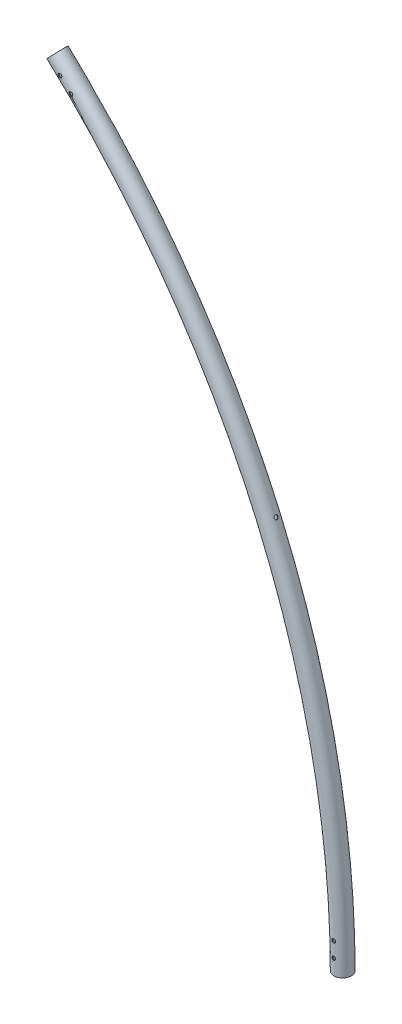
from build123d import *

# Parameters (mm, degrees)
SKETCH4_R               = 14.732
SKETCH4_R_2             = 13.3223
SKETCH11_R              = 3.175
CUT_EXTRUDE1_DEPTH      = 41.91
CUT_EXTRUDE2_DEPTH      = 1875.371093861
CUT_EXTRUDE2_DEPTH_BACK = 1875.371093861
SKETCH12_R              = 3.175


with BuildPart() as part:
    # Sweep3: sweep along a path in Sketch2
    with BuildLine(Plane.XY) as sweep3_path:
        ThreePointArc((1027.134565113, 1108.612770605), (1384.979450796, 604.863299326), (1511.3, 0))
    # Sketch4 → Sweep3 (sweep)
    with BuildSketch(Plane(origin=(0, 0, 0), x_dir=(1, 0, 0), z_dir=(0, 1, 0))):
        with Locations((1496.568, 0)):
            Circle(SKETCH4_R)
        with Locations((1496.568, 0)):
            Circle(SKETCH4_R_2, mode=Mode.SUBTRACT)
    sweep(path=sweep3_path.line)

    # Sketch11 → Cut-Extrude1 (cut)
    with BuildSketch(Plane(origin=(1384.979450796, 604.863299326, 0), x_dir=(0, 0, -1), z_dir=(0.9164159669134189, 0.4002271549834462, 0))):
        with Locations(Location((0, 0, 0), (0, 0, 306.379132969))):
            Circle(SKETCH11_R)
    extrude(amount=-CUT_EXTRUDE1_DEPTH, mode=Mode.SUBTRACT)

    # Sketch12 → Cut-Extrude2 (cut, two sides: drawn at the far end of the back side and taken through both)
    with BuildSketch(Plane.XY.offset(-CUT_EXTRUDE2_DEPTH_BACK)):
        with Locations(Location((1035.654688965, 1080.435837539, 0), (0, 0, 137.517893676))):
            Circle(SKETCH12_R)
        with Locations(Location((1054.017540677, 1062.882413967, 0), (0, 0, 309.405149456))):
            Circle(SKETCH12_R)
        with Locations(Location((1495.93786202, 25.4, 0), (0, 0, 278.414229996))):
            Circle(SKETCH12_R)
        with Locations(Location((1495.93786202, 50.8, 0), (0, 0, 267.690998334))):
            Circle(SKETCH12_R)
    extrude(amount=CUT_EXTRUDE2_DEPTH + CUT_EXTRUDE2_DEPTH_BACK, mode=Mode.SUBTRACT)


solid = part.part
